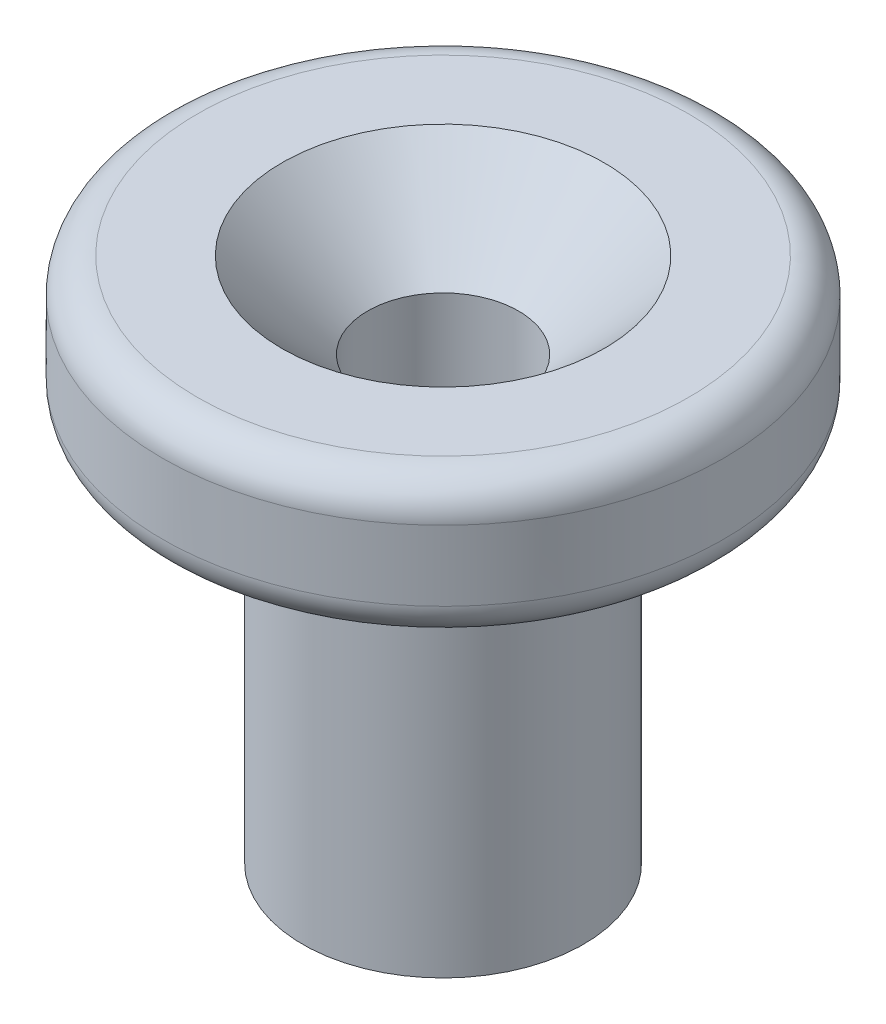
from build123d import *

# Parameters (mm, degrees)
REDONDEO1_R                                          = 1
AVELLANADO_PARA_TORNILLO_CON_CABEZA_AVEL_D           = 4.3
AVELLANADO_PARA_TORNILLO_CON_CABEZA_AVEL_CSINK_D     = 9.18
AVELLANADO_PARA_TORNILLO_CON_CABEZA_AVEL_CSINK_ANGLE = 90


with BuildPart() as part:
    # Croquis1 → Revolución1 (revolve)
    with BuildSketch(Plane.XY, mode=Mode.PRIVATE) as revoluci_n1_sk:
        Polygon((0, 15), (8, 15), (8, 11), (4, 11), (4, 0), (0, 0), align=None)
    revolve(revoluci_n1_sk.sketch.rotate(Axis((0, 0, 0), (0, 1, 0)), 90), axis=Axis((0, 0, 0), (0, 1, 0)))

    # Redondeo1
    redondeo1_edges = [part.edges().sort_by_distance(p)[0] for p in [
        (0, 11, 4),
        (0, 11, 8),
        (0, 15, 8),
    ]]
    fillet(redondeo1_edges, radius=REDONDEO1_R)

    # Avellanado para tornillo con cabeza avellanada de clavija hexagonal de M41 (through all)
    with Locations(Plane(origin=(0, 15, 0), x_dir=(1, 0, 0), z_dir=(0, 1, 0))):
        with Locations((0, 0)):
            CounterSinkHole(AVELLANADO_PARA_TORNILLO_CON_CABEZA_AVEL_D / 2, AVELLANADO_PARA_TORNILLO_CON_CABEZA_AVEL_CSINK_D / 2, counter_sink_angle=AVELLANADO_PARA_TORNILLO_CON_CABEZA_AVEL_CSINK_ANGLE)


solid = part.part
